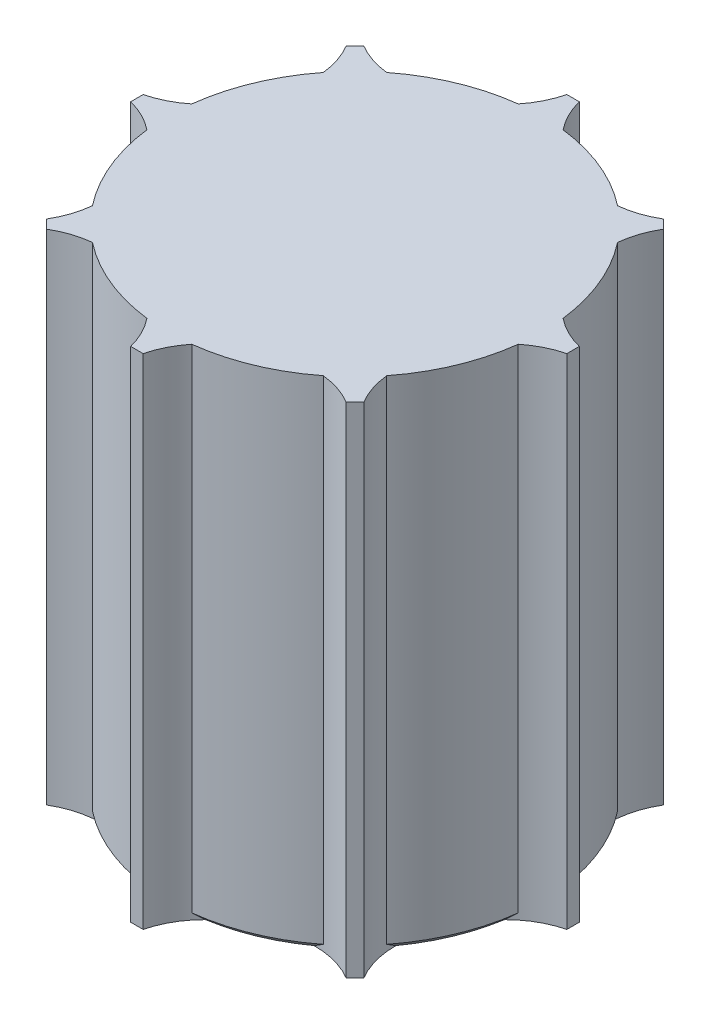
from build123d import *

# Parameters (mm, degrees)
SKETCH2_R           = 6
BOSS_EXTRUDE2_DEPTH = 5
SKETCH4_R           = 15
BOSS_EXTRUDE3_DEPTH = 40
BOSS_EXTRUDE4_START = -40
BOSS_EXTRUDE4_DEPTH = 40
CHAMFER1_SIZE       = 0.5
CHAMFER2_SIZE       = 0.5


with BuildPart() as part:
    # Sketch2 → Boss-Extrude2 (new body)
    with BuildSketch(Plane(origin=(0, 0, 0), x_dir=(1, 0, 0), z_dir=(0, 1, 0))):
        with Locations(Location((0, 0, 0), (0, 0, 270))):
            Circle(SKETCH2_R)
    extrude(amount=BOSS_EXTRUDE2_DEPTH)

    # Sketch4 → Boss-Extrude3 (add)
    with BuildSketch(Plane(origin=(0, 5, 0), x_dir=(1, 0, 0), z_dir=(0, 1, 0))):
        with Locations(Location((0, 0, 0), (0, 0, 270))):
            Circle(SKETCH4_R)
    extrude(amount=BOSS_EXTRUDE3_DEPTH)

    # Sketch5 → Boss-Extrude4 (add)
    with BuildSketch(Plane(origin=(0, 45, 0), x_dir=(1, 0, 0), z_dir=(0, 1, 0)).offset(BOSS_EXTRUDE4_START)):
        with BuildLine():
            ThreePointArc((-11.802749471, 9.257165059), (-10.606601718, 10.606601718), (-9.257165059, 11.802749471))
            ThreePointArc((-9.257165059, 11.802749471), (-10.686189168, 12.11373051), (-12.015763486, 12.722870267))
            Line((-12.015763486, 12.722870267), (-12.722870267, 12.015763486))
            ThreePointArc((-12.722870267, 12.015763486), (-12.11373051, 10.686189168), (-11.802749471, 9.257165059))
        make_face()
        with BuildLine():
            ThreePointArc((-1.8, 14.891608375), (-0.901630293, 14.972877573), (0, 15))
            Line((0, 15), (0, 17.492855685))
            Line((0, 17.492855685), (-0.5, 17.492855685))
            ThreePointArc((-0.5, 17.492855685), (-1.009424163, 16.121977815), (-1.8, 14.891608375))
        make_face()
        with BuildLine():
            Line((0, 17.492855685), (0, 15))
            ThreePointArc((0, 15), (0.901630293, 14.972877573), (1.8, 14.891608375))
            ThreePointArc((1.8, 14.891608375), (1.009424163, 16.121977815), (0.5, 17.492855685))
            Line((0.5, 17.492855685), (0, 17.492855685))
        make_face()
        with BuildLine():
            ThreePointArc((12.015763486, 12.722870267), (10.686189168, 12.11373051), (9.257165059, 11.802749471))
            ThreePointArc((9.257165059, 11.802749471), (10.606601718, 10.606601718), (11.802749471, 9.257165059))
            ThreePointArc((11.802749471, 9.257165059), (12.11373051, 10.686189168), (12.722870267, 12.015763486))
            Line((12.722870267, 12.015763486), (12.015763486, 12.722870267))
        make_face()
        with BuildLine():
            ThreePointArc((-14.891608375, -1.8), (-15, 0), (-14.891608375, 1.8))
            ThreePointArc((-14.891608375, 1.8), (-16.121977815, 1.009424163), (-17.492855685, 0.5))
            Line((-17.492855685, 0.5), (-17.492855685, -0.5))
            ThreePointArc((-17.492855685, -0.5), (-16.121977815, -1.009424163), (-14.891608375, -1.8))
        make_face()
        with BuildLine():
            ThreePointArc((-9.257165059, -11.802749471), (-10.606601718, -10.606601718), (-11.802749471, -9.257165059))
            ThreePointArc((-11.802749471, -9.257165059), (-12.11373051, -10.686189168), (-12.722870267, -12.015763486))
            Line((-12.722870267, -12.015763486), (-12.015763486, -12.722870267))
            ThreePointArc((-12.015763486, -12.722870267), (-10.686189168, -12.11373051), (-9.257165059, -11.802749471))
        make_face()
        with BuildLine():
            ThreePointArc((1.8, -14.891608375), (0, -15), (-1.8, -14.891608375))
            ThreePointArc((-1.8, -14.891608375), (-1.009424163, -16.121977815), (-0.5, -17.492855685))
            Line((-0.5, -17.492855685), (0.5, -17.492855685))
            ThreePointArc((0.5, -17.492855685), (1.009424163, -16.121977815), (1.8, -14.891608375))
        make_face()
        with BuildLine():
            Line((12.015763486, -12.722870267), (12.722870267, -12.015763486))
            ThreePointArc((12.722870267, -12.015763486), (12.11373051, -10.686189168), (11.802749471, -9.257165059))
            ThreePointArc((11.802749471, -9.257165059), (10.606601718, -10.606601718), (9.257165059, -11.802749471))
            ThreePointArc((9.257165059, -11.802749471), (10.686189168, -12.11373051), (12.015763486, -12.722870267))
        make_face()
        with BuildLine():
            ThreePointArc((17.492855685, 0.5), (16.121977815, 1.009424163), (14.891608375, 1.8))
            ThreePointArc((14.891608375, 1.8), (14.972877573, 0.901630293), (15, 0))
            ThreePointArc((15, 0), (14.972877573, -0.901630293), (14.891608375, -1.8))
            ThreePointArc((14.891608375, -1.8), (16.121977815, -1.009424163), (17.492855685, -0.5))
            Line((17.492855685, -0.5), (17.492855685, 0.5))
        make_face()
    extrude(amount=BOSS_EXTRUDE4_DEPTH)

    # Chamfer1
    chamfer1_edges = [part.edges().sort_by_distance(p)[0] for p in [
        (0, 0, -6),
    ]]
    chamfer(chamfer1_edges, length=CHAMFER1_SIZE)

    # Chamfer2
    chamfer2_edges = [part.edges().sort_by_distance(p)[0] for p in [
        (-13.858192988, 5, -5.740251485),
        (-5.740251485, 5, -13.858192988),
        (5.740251485, 5, -13.858192988),
        (-13.858192988, 5, 5.740251485),
        (-5.740251485, 5, 13.858192988),
        (5.740251485, 5, 13.858192988),
        (13.858192988, 5, 5.740251485),
        (13.858192988, 5, -5.740251485),
    ]]
    chamfer(chamfer2_edges, length=CHAMFER2_SIZE)


solid = part.part
